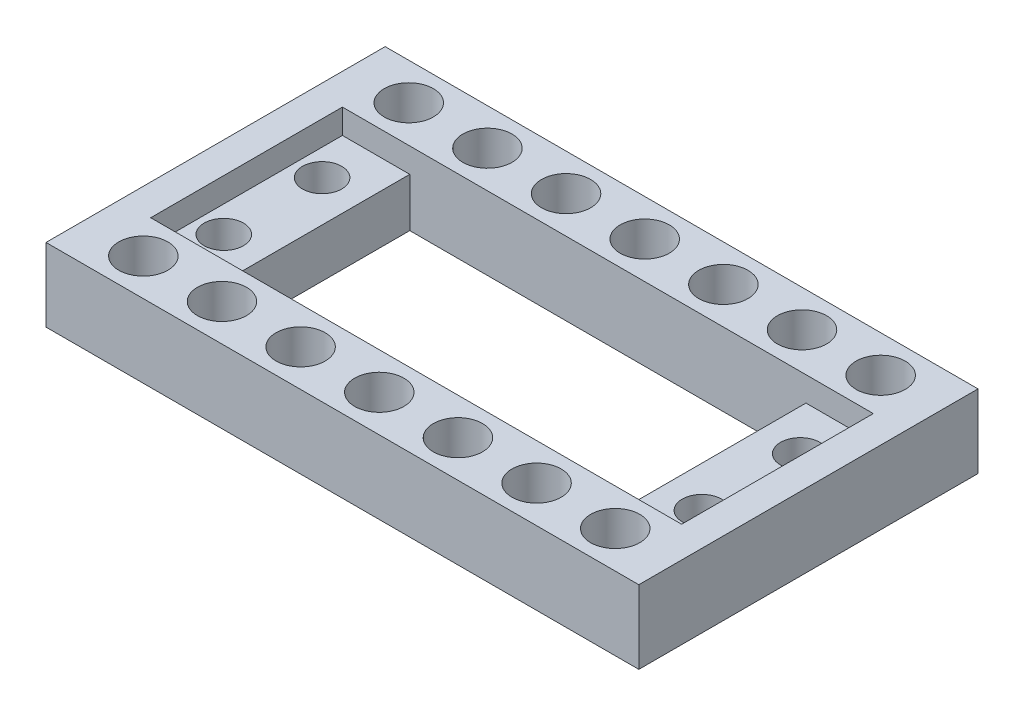
from build123d import *

# Parameters (mm, degrees)
SKETCH1_W           = 60.3
SKETCH1_H           = 34.5
SKETCH1_R           = 2
SKETCH1_W_2         = 40.3
SKETCH1_H_2         = 19.5
BOSS_EXTRUDE1_DEPTH = 7.46
SKETCH3_W           = 54
SKETCH3_H           = 19.5
CUT_EXTRUDE1_DEPTH  = 2.5
SKETCH4_R           = 2.5
CUT_EXTRUDE2_DEPTH  = 36.527969264


with BuildPart() as part:
    # Sketch1 → Boss-Extrude1 (new body)
    with BuildSketch(Plane(origin=(0, 0, 0), x_dir=(1, 0, 0), z_dir=(0, 1, 0))):
        Rectangle(SKETCH1_W, SKETCH1_H)
        with Locations(Location((-24.315, -5, 0), (0, 0, 90))):
            Circle(SKETCH1_R, mode=Mode.SUBTRACT)
        with Locations(Location((-24.315, 5, 0), (0, 0, 90))):
            Circle(SKETCH1_R, mode=Mode.SUBTRACT)
        with Locations(Location((24.315, -5, 0), (0, 0, 90))):
            Circle(SKETCH1_R, mode=Mode.SUBTRACT)
        with Locations(Location((24.315, 5, 0), (0, 0, 90))):
            Circle(SKETCH1_R, mode=Mode.SUBTRACT)
        Rectangle(SKETCH1_W_2, SKETCH1_H_2, mode=Mode.SUBTRACT)
    extrude(amount=BOSS_EXTRUDE1_DEPTH)

    # Sketch3 → Cut-Extrude1 (cut)
    with BuildSketch(Plane(origin=(0, 7.46, 0), x_dir=(1, 0, 0), z_dir=(0, 1, 0))):
        Rectangle(SKETCH3_W, SKETCH3_H)
    extrude(amount=-CUT_EXTRUDE1_DEPTH, mode=Mode.SUBTRACT)

    # Sketch4 → Cut-Extrude2 (cut, through all)
    with BuildSketch(Plane(origin=(0, 7.46, 0), x_dir=(1, 0, 0), z_dir=(0, 1, 0))):
        with Locations(Location((0, 13.5, 0), (0, 0, 270))):
            Circle(SKETCH4_R)
        with Locations(Location((8, 13.5, 0), (0, 0, 270))):
            Circle(SKETCH4_R)
        with Locations(Location((16, 13.5, 0), (0, 0, 270))):
            Circle(SKETCH4_R)
        with Locations(Location((24, 13.5, 0), (0, 0, 270))):
            Circle(SKETCH4_R)
        with Locations(Location((-24, 13.5, 0), (0, 0, 270))):
            Circle(SKETCH4_R)
        with Locations(Location((-16, 13.5, 0), (0, 0, 270))):
            Circle(SKETCH4_R)
        with Locations(Location((-8, 13.5, 0), (0, 0, 270))):
            Circle(SKETCH4_R)
        with Locations(Location((24, -13.5, 0), (0, 0, 270))):
            Circle(SKETCH4_R)
        with Locations(Location((16, -13.5, 0), (0, 0, 270))):
            Circle(SKETCH4_R)
        with Locations(Location((8, -13.5, 0), (0, 0, 270))):
            Circle(SKETCH4_R)
        with Locations(Location((0, -13.5, 0), (0, 0, 270))):
            Circle(SKETCH4_R)
        with Locations(Location((-8, -13.5, 0), (0, 0, 270))):
            Circle(SKETCH4_R)
        with Locations(Location((-16, -13.5, 0), (0, 0, 270))):
            Circle(SKETCH4_R)
        with Locations(Location((-24, -13.5, 0), (0, 0, 270))):
            Circle(SKETCH4_R)
    extrude(amount=-CUT_EXTRUDE2_DEPTH, mode=Mode.SUBTRACT)


solid = part.part
